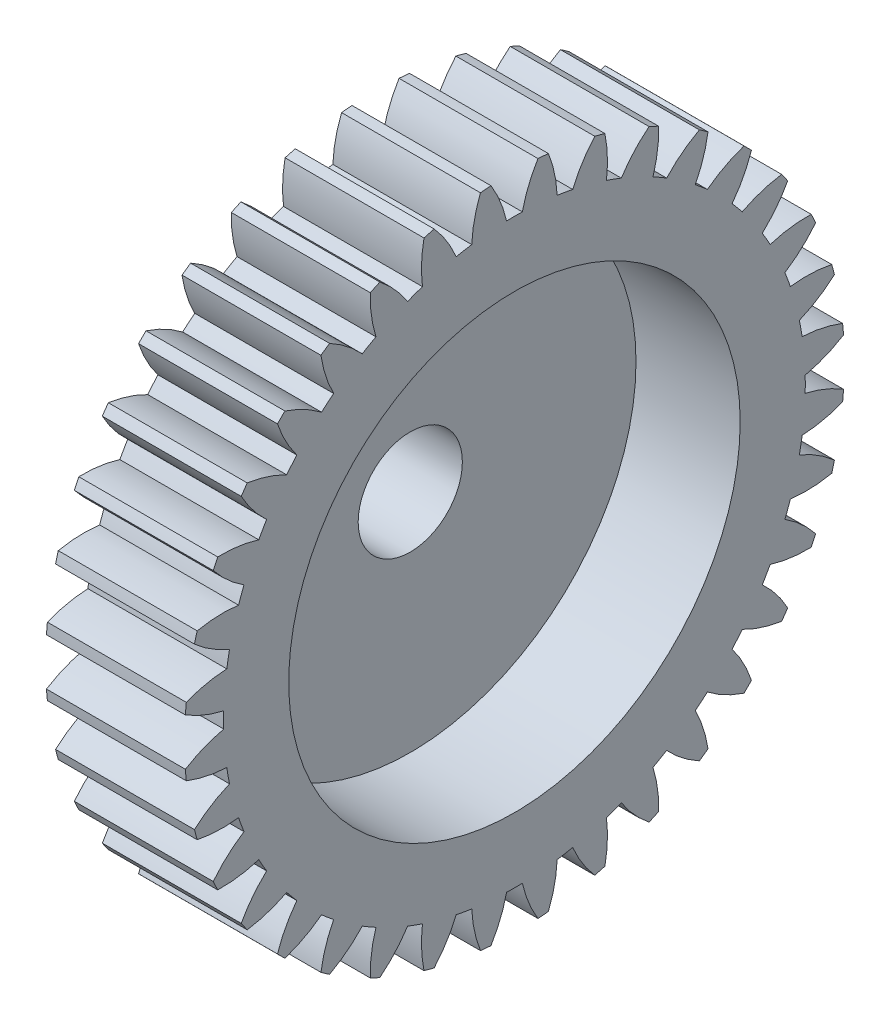
from build123d import *

# Parameters (mm, degrees)
BASPROSKE_W        = 12
BASPROSKE_H        = 9.5
TOOTHCUT_DEPTH     = 19.013883535
TEETHCUTS_COUNT    = 36
TEETHCUTS_ANGLE    = 350
HUBNEAONESKE_R     = 2.5
HUBNEARONE_DEPTH   = 3.0000508
BORSKE_R           = 1.5
BORE_DEPTH         = 15.0000508
SKETCH1_R          = 20.849268772
CUT_EXTRUDE1_DEPTH = 8
SKETCH2_R          = 6.5
CUT_EXTRUDE2_DEPTH = 3


with BuildPart() as part:
    # BasProSke → Base-Revolve (revolve)
    with BuildSketch(Plane(origin=(0, 0, 0), x_dir=(1, 0, 0), z_dir=(0, 1, 0))):
        with Locations((6, 4.75)):
            Rectangle(BASPROSKE_W, BASPROSKE_H)
    revolve(axis=Axis((-10, 0, 0), (1, 0, 0)))

    # TooCutSke → ToothCut (cut, through all)
    with BuildSketch(Plane(origin=(0, 0, 0), x_dir=(0, 0, -1), z_dir=(1, 0, 0))):
        with BuildLine():
            ThreePointArc((0.227221176, 8.370916708), (0, 8.374), (-0.227221176, 8.370916708))
            ThreePointArc((-0.227221176, 8.370916708), (-0.411410437, 8.955426484), (-0.69207336, 9.500225241))
            ThreePointArc((-0.69207336, 9.500225241), (0, 9.5254), (0.69207336, 9.500225241))
            ThreePointArc((0.69207336, 9.500225241), (0.411410437, 8.955426484), (0.227221176, 8.370916708))
        make_face()
    toothcut = extrude(amount=TOOTHCUT_DEPTH, mode=Mode.SUBTRACT)

    # TeethCuts: ToothCut ×36 about axis
    teethcuts_axis = Axis((-10, 0, 0), (1, 0, 0))
    for i in range(1, TEETHCUTS_COUNT):
        add(toothcut.rotate(teethcuts_axis, i * TEETHCUTS_ANGLE / (TEETHCUTS_COUNT - 1)), mode=Mode.SUBTRACT)

    # HubNeaOneSke → HubNearOne (add)
    with BuildSketch(Plane.ZY):
        Circle(HUBNEAONESKE_R)
    extrude(amount=HUBNEARONE_DEPTH)

    # BorSke → Bore (cut, symmetric)
    with BuildSketch(Plane(origin=(0, 0, 0), x_dir=(0, 0, -1), z_dir=(1, 0, 0))):
        Circle(BORSKE_R)
    extrude(amount=BORE_DEPTH, both=True, mode=Mode.SUBTRACT)

    # Sketch1 → Cut-Extrude1 (cut)
    with BuildSketch(Plane(origin=(12, 0, 0), x_dir=(0, 0, -1), z_dir=(1, 0, 0))):
        Circle(SKETCH1_R)
    extrude(amount=-CUT_EXTRUDE1_DEPTH, mode=Mode.SUBTRACT)

    # Sketch2 → Cut-Extrude2 (cut)
    with BuildSketch(Plane(origin=(4, 0, 0), x_dir=(0, 0, -1), z_dir=(1, 0, 0))):
        Circle(SKETCH2_R)
    extrude(amount=-CUT_EXTRUDE2_DEPTH, mode=Mode.SUBTRACT)


solid = part.part
